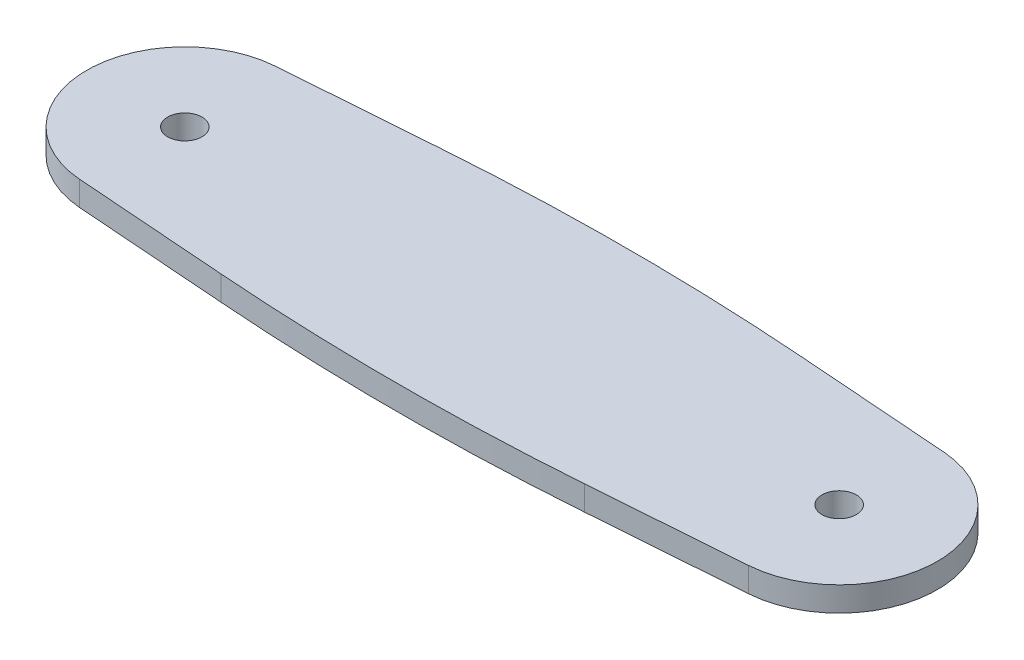
from build123d import *

# Parameters (mm, degrees)
SKETCH_1_R      = 2.1
EXTRUDE_1_DEPTH = 3
FILLET_1_R      = 300


with BuildPart() as part:
    # 草图1 → 凸台-拉伸1 (new body)
    with BuildSketch(Plane(origin=(0, 0, 0), x_dir=(1, 0, 0), z_dir=(0, 1, 0))):
        with BuildLine():
            Line((-0.887671233, 11.967123288), (40, 15))
            Line((40, 15), (80.887671233, 11.967123288))
            ThreePointArc((80.887671233, 11.967123288), (92, 0), (80.887671233, -11.967123288))
            Line((80.887671233, -11.967123288), (40, -15))
            Line((40, -15), (-0.887671233, -11.967123288))
            ThreePointArc((-0.887671233, -11.967123288), (-12, 0), (-0.887671233, 11.967123288))
        make_face()
        with Locations(Location((0, 0, 0), (0, 0, 270))):
            Circle(SKETCH_1_R, mode=Mode.SUBTRACT)
        with Locations(Location((80, 0, 0), (0, 0, 270))):
            Circle(SKETCH_1_R, mode=Mode.SUBTRACT)
    extrude(amount=EXTRUDE_1_DEPTH)

    # 圆角1
    fillet_1_edges = [part.edges().sort_by_distance(p)[0] for p in [
        (40, 1.5, 15),
        (40, 1.5, -15),
    ]]
    fillet(fillet_1_edges, radius=FILLET_1_R)


solid = part.part
